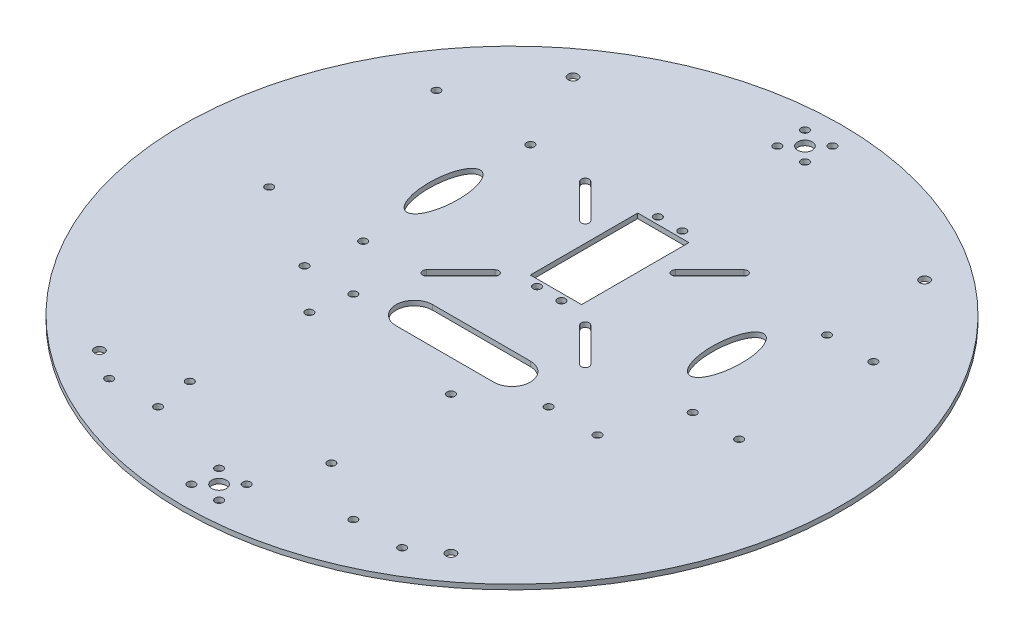
from build123d import *

# Parameters (mm, degrees)
SKETCH_1_R          = 135
EXTRUDE_1_DEPTH     = 2
SKETCH_562_R        = 1.6
SKETCH_562_W        = 21
SKETCH_562_H        = 44
CUT_EXTRUDE_1_DEPTH = 10
SKETCH_1031_R       = 1.6
CUT_EXTRUDE_2_DEPTH = 10
SKETCH_4_R          = 2
SKETCH_4_R_2        = 3
SKETCH_4_R_3        = 1.6
CUT_EXTRUDE_3_DEPTH = 10
CUT_EXTRUDE_4_DEPTH = 10
SKETCH_6_R          = 1.6
CUT_EXTRUDE_7_DEPTH = 10


with BuildPart() as part:
    # 草图1 → 凸台-拉伸1 (new body)
    with BuildSketch(Plane(origin=(0, 0, 0), x_dir=(1, 0, 0), z_dir=(0, 1, 0))):
        with Locations(Location((0, 0, 0), (0, 0, 270))):
            Circle(SKETCH_1_R)
    extrude(amount=EXTRUDE_1_DEPTH)

    # Sketch 562 → 切除-拉伸1 (cut)
    with BuildSketch(Plane(origin=(0, 2, 0), x_dir=(1, 0, 0), z_dir=(0, 1, 0))):
        with Locations(Location((-5, 64.75, 0), (0, 0, 270))):
            Circle(SKETCH_562_R)
        with Locations(Location((5, 64.75, 0), (0, 0, 270))):
            Circle(SKETCH_562_R)
        with Locations(Location((-5, 15.25, 0), (0, 0, 270))):
            Circle(SKETCH_562_R)
        with Locations(Location((5, 15.25, 0), (0, 0, 270))):
            Circle(SKETCH_562_R)
        with Locations(Location((18.5, 48.5, 0), (0, 0, 270))):
            Circle(SKETCH_562_R)
        with Locations(Location((18.5, 11.5, 0), (0, 0, 270))):
            Circle(SKETCH_562_R)
        with Locations(Location((-18.5, 11.5, 0), (0, 0, 270))):
            Circle(SKETCH_562_R)
        with Locations(Location((-18.5, 48.5, 0), (0, 0, 270))):
            Circle(SKETCH_562_R)
        with Locations((0, 40)):
            Rectangle(SKETCH_562_W, SKETCH_562_H)
    extrude(amount=-CUT_EXTRUDE_1_DEPTH, mode=Mode.SUBTRACT)

    # Sketch 1031 → 切除-拉伸2 (cut)
    with BuildSketch(Plane(origin=(0, 2, 0), x_dir=(1, 0, 0), z_dir=(0, 1, 0))):
        with Locations(Location((-60, -25, 0), (0, 0, 270))):
            Circle(SKETCH_1031_R)
        with Locations(Location((-40, -25, 0), (0, 0, 270))):
            Circle(SKETCH_1031_R)
        with Locations(Location((40, -25, 0), (0, 0, 270))):
            Circle(SKETCH_1031_R)
        with Locations(Location((60, -25, 0), (0, 0, 270))):
            Circle(SKETCH_1031_R)
        with Locations(Location((60, -105, 0), (0, 0, 270))):
            Circle(SKETCH_1031_R)
        with Locations(Location((40, -105, 0), (0, 0, 270))):
            Circle(SKETCH_1031_R)
        with Locations(Location((-40, -105, 0), (0, 0, 270))):
            Circle(SKETCH_1031_R)
        with Locations(Location((-60, -105, 0), (0, 0, 270))):
            Circle(SKETCH_1031_R)
        with Locations(Location((-42.5, -89.5, 0), (0, 0, 270))):
            Circle(SKETCH_1031_R)
        with Locations(Location((-42.5, -40.5, 0), (0, 0, 270))):
            Circle(SKETCH_1031_R)
        with Locations(Location((15.5, -40.5, 0), (0, 0, 270))):
            Circle(SKETCH_1031_R)
        with Locations(Location((15.5, -89.5, 0), (0, 0, 270))):
            Circle(SKETCH_1031_R)
    extrude(amount=-CUT_EXTRUDE_2_DEPTH, mode=Mode.SUBTRACT)

    # 草图4 → 切除-拉伸3 (cut)
    with BuildSketch(Plane(origin=(0, 2, 0), x_dir=(1, 0, 0), z_dir=(0, 1, 0))):
        with Locations(Location((-72, 97, 0), (0, 0, 270))):
            Circle(SKETCH_4_R)
        with Locations(Location((72, 97, 0), (0, 0, 270))):
            Circle(SKETCH_4_R)
        with Locations(Location((72, -97, 0), (0, 0, 270))):
            Circle(SKETCH_4_R)
        with Locations(Location((-72, -97, 0), (0, 0, 270))):
            Circle(SKETCH_4_R)
        with Locations(Location((0, -120, 0), (0, 0, 270))):
            Circle(SKETCH_4_R_2)
        with Locations(Location((-5.656854249, -125.656854249, 0), (0, 0, 270))):
            Circle(SKETCH_4_R_3)
        with Locations(Location((-5.656854249, -114.343145751, 0), (0, 0, 270))):
            Circle(SKETCH_4_R_3)
        with Locations(Location((5.656854249, -114.343145751, 0), (0, 0, 270))):
            Circle(SKETCH_4_R_3)
        with Locations(Location((5.656854249, -125.656854249, 0), (0, 0, 270))):
            Circle(SKETCH_4_R_3)
        with Locations(Location((5.656854249, 125.656854249, 0), (0, 0, 270))):
            Circle(SKETCH_4_R_3)
        with Locations(Location((5.656854249, 114.343145751, 0), (0, 0, 270))):
            Circle(SKETCH_4_R_3)
        with Locations(Location((-5.656854249, 114.343145751, 0), (0, 0, 270))):
            Circle(SKETCH_4_R_3)
        with Locations(Location((-5.656854249, 125.656854249, 0), (0, 0, 270))):
            Circle(SKETCH_4_R_3)
        with Locations(Location((0, 120, 0), (0, 0, 270))):
            Circle(SKETCH_4_R_2)
        with BuildLine():
            Line((-20, -12.5), (20, -12.5))
            ThreePointArc((20, -12.5), (27.5, -20), (20, -27.5))
            Line((20, -27.5), (-20, -27.5))
            ThreePointArc((-20, -27.5), (-27.5, -20), (-20, -12.5))
        make_face()
    extrude(amount=-CUT_EXTRUDE_3_DEPTH, mode=Mode.SUBTRACT)

    # 草图5 → 切除-拉伸4 (cut)
    with BuildSketch(Plane(origin=(0, 2, 0), x_dir=(1, 0, 0), z_dir=(0, 1, 0))):
        with BuildLine():
            Line((-31.36862915, 63.63137085), (-17.36862915, 49.63137085))
            ThreePointArc((-17.36862915, 49.63137085), (-17.36862915, 47.36862915), (-19.63137085, 47.36862915))
            Line((-19.63137085, 47.36862915), (-33.63137085, 61.36862915))
            ThreePointArc((-33.63137085, 61.36862915), (-33.63137085, 63.63137085), (-31.36862915, 63.63137085))
        make_face()
        with BuildLine():
            Line((33.63137085, 61.36862915), (19.63137085, 47.36862915))
            ThreePointArc((19.63137085, 47.36862915), (17.36862915, 47.36862915), (17.36862915, 49.63137085))
            Line((17.36862915, 49.63137085), (31.36862915, 63.63137085))
            ThreePointArc((31.36862915, 63.63137085), (33.63137085, 63.63137085), (33.63137085, 61.36862915))
        make_face()
        with BuildLine():
            Line((31.36862915, -3.63137085), (17.36862915, 10.36862915))
            ThreePointArc((17.36862915, 10.36862915), (17.36862915, 12.63137085), (19.63137085, 12.63137085))
            Line((19.63137085, 12.63137085), (33.63137085, -1.36862915))
            ThreePointArc((33.63137085, -1.36862915), (33.63137085, -3.63137085), (31.36862915, -3.63137085))
        make_face()
        with BuildLine():
            Line((-33.63137085, -1.36862915), (-19.63137085, 12.63137085))
            ThreePointArc((-19.63137085, 12.63137085), (-17.36862915, 12.63137085), (-17.36862915, 10.36862915))
            Line((-17.36862915, 10.36862915), (-31.36862915, -3.63137085))
            ThreePointArc((-31.36862915, -3.63137085), (-33.63137085, -3.63137085), (-33.63137085, -1.36862915))
        make_face()
    extrude(amount=-CUT_EXTRUDE_4_DEPTH, mode=Mode.SUBTRACT)

    # 草图6 → 切除-拉伸7 (cut)
    with BuildSketch(Plane(origin=(0, 2, 0), x_dir=(1, 0, 0), z_dir=(0, 1, 0))):
        with Locations(Location((71.537199543, 2.5, 0), (0, 0, 270))):
            Circle(SKETCH_6_R)
        with Locations(Location((90.537199543, 2.5, 0), (0, 0, 270))):
            Circle(SKETCH_6_R)
        with Locations(Location((90.537199543, 57.5, 0), (0, 0, 270))):
            Circle(SKETCH_6_R)
        with Locations(Location((71.537199543, 57.5, 0), (0, 0, 270))):
            Circle(SKETCH_6_R)
        with Locations(Location((-95.215957975, -4.25, 0), (0, 0, 270))):
            Circle(SKETCH_6_R)
        with Locations(Location((-56.715957975, -4.25, 0), (0, 0, 270))):
            Circle(SKETCH_6_R)
        with Locations(Location((-95.215957975, 64.25, 0), (0, 0, 270))):
            Circle(SKETCH_6_R)
        with Locations(Location((-56.715957975, 64.25, 0), (0, 0, 270))):
            Circle(SKETCH_6_R)
        with BuildLine():
            add(Edge.make_bspline(
                [(-58.031053316, 15), (-47.63874847, 15), (-52.834900893, 37.5), (-58.031053316, 60), (-63.227205738, 37.5), (-68.423358161, 15), (-58.031053316, 15)],
                knots=[0, 0, 0, 2.094395102, 2.094395102, 4.188790205, 4.188790205, 6.283185307, 6.283185307, 6.283185307], degree=2, weights=[1, 0.5, 1, 0.5, 1, 0.5, 1]))
        make_face()
        with BuildLine():
            add(Edge.make_bspline(
                [(58.031053316, 45), (47.63874847, 45), (52.834900893, 22.5), (58.031053316, 0), (63.227205738, 22.5), (68.423358161, 45), (58.031053316, 45)],
                knots=[0, 0, 0, 2.094395102, 2.094395102, 4.188790205, 4.188790205, 6.283185307, 6.283185307, 6.283185307], degree=2, weights=[1, 0.5, 1, 0.5, 1, 0.5, 1]))
        make_face()
    extrude(amount=-CUT_EXTRUDE_7_DEPTH, mode=Mode.SUBTRACT)


solid = part.part
